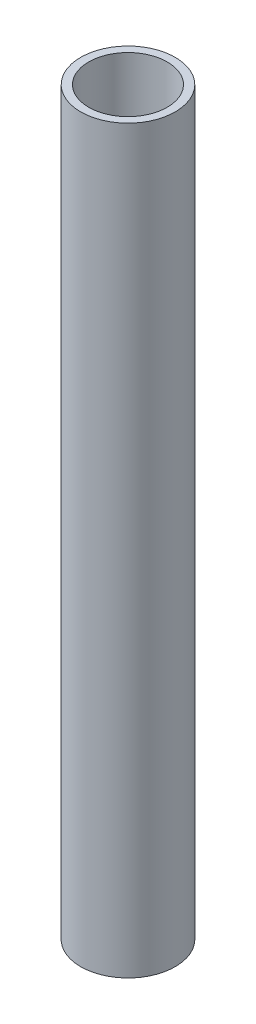
from build123d import *

# Parameters (mm, degrees)
SKETCH1_R           = 21.082
SKETCH1_R_2         = 17.526
BOSS_EXTRUDE1_DEPTH = 330.2


with BuildPart() as part:
    # Sketch1 → Boss-Extrude1 (new body)
    with BuildSketch(Plane(origin=(0, 0, 0), x_dir=(1, 0, 0), z_dir=(0, 1, 0))):
        with Locations(Location((0, 0, 0), (0, 0, 270))):
            Circle(SKETCH1_R)
        with Locations(Location((0, 0, 0), (0, 0, 270))):
            Circle(SKETCH1_R_2, mode=Mode.SUBTRACT)
    extrude(amount=BOSS_EXTRUDE1_DEPTH)


solid = part.part
